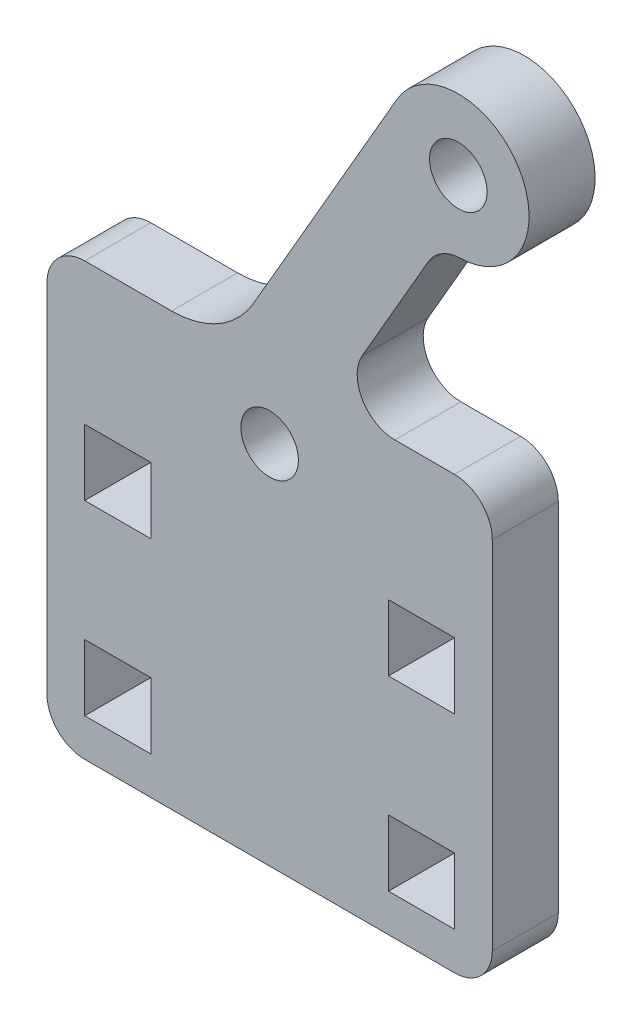
from build123d import *

# Parameters (mm, degrees)
SKETCH1_R           = 1.525
SKETCH1_W           = 3.5
SKETCH1_H           = 3.5
BOSS_EXTRUDE1_DEPTH = 3.5
FILLET1_R           = 2
FILLET2_R           = 2
FILLET3_R           = 5


with BuildPart() as part:
    # Sketch1 → Boss-Extrude1 (new body)
    with BuildSketch(Plane.XY):
        with BuildLine():
            Line((-11.8, 0), (11.8, 0))
            Line((11.8, 0), (11.8, 22.88))
            Line((11.8, 22.88), (3.175426481, 22.88))
            Line((3.175426481, 22.88), (9.058921367, 33.070512069))
            ThreePointArc((9.058921367, 33.070512069), (13.458683639, 38.149648334), (6.752404736, 38.575508076))
            Line((6.752404736, 38.575508076), (-2.309401077, 22.88))
            Line((-2.309401077, 22.88), (-11.8, 22.88))
            Line((-11.8, 22.88), (-11.8, 0))
        make_face()
        with Locations((0, 19.38)):
            Circle(SKETCH1_R, mode=Mode.SUBTRACT)
        with Locations((10, 36.700508076)):
            Circle(SKETCH1_R, mode=Mode.SUBTRACT)
        with Locations((-8.05, 3.75)):
            Rectangle(SKETCH1_W, SKETCH1_H, mode=Mode.SUBTRACT)
        with Locations((8.05, 3.75)):
            Rectangle(SKETCH1_W, SKETCH1_H, mode=Mode.SUBTRACT)
        with Locations((8.05, 13.63)):
            Rectangle(SKETCH1_W, SKETCH1_H, mode=Mode.SUBTRACT)
        with Locations((-8.05, 13.63)):
            Rectangle(SKETCH1_W, SKETCH1_H, mode=Mode.SUBTRACT)
    extrude(amount=BOSS_EXTRUDE1_DEPTH)

    # Fillet1
    fillet1_edges = [part.edges().sort_by_distance(p)[0] for p in [
        (-11.8, 22.88, 1.75),
        (11.8, 22.88, 1.75),
        (11.8, 0, 1.75),
        (-11.8, 0, 1.75),
    ]]
    fillet(fillet1_edges, radius=FILLET1_R)

    # Fillet2
    fillet2_edges = [part.edges().sort_by_distance(p)[0] for p in [
        (9.058921367, 33.070512069, 1.75),
        (3.175426481, 22.88, 1.75),
    ]]
    fillet(fillet2_edges, radius=FILLET2_R)

    # Fillet3
    fillet3_edges = [part.edges().sort_by_distance(p)[0] for p in [
        (-2.309401077, 22.88, 1.75),
    ]]
    fillet(fillet3_edges, radius=FILLET3_R)


solid = part.part
